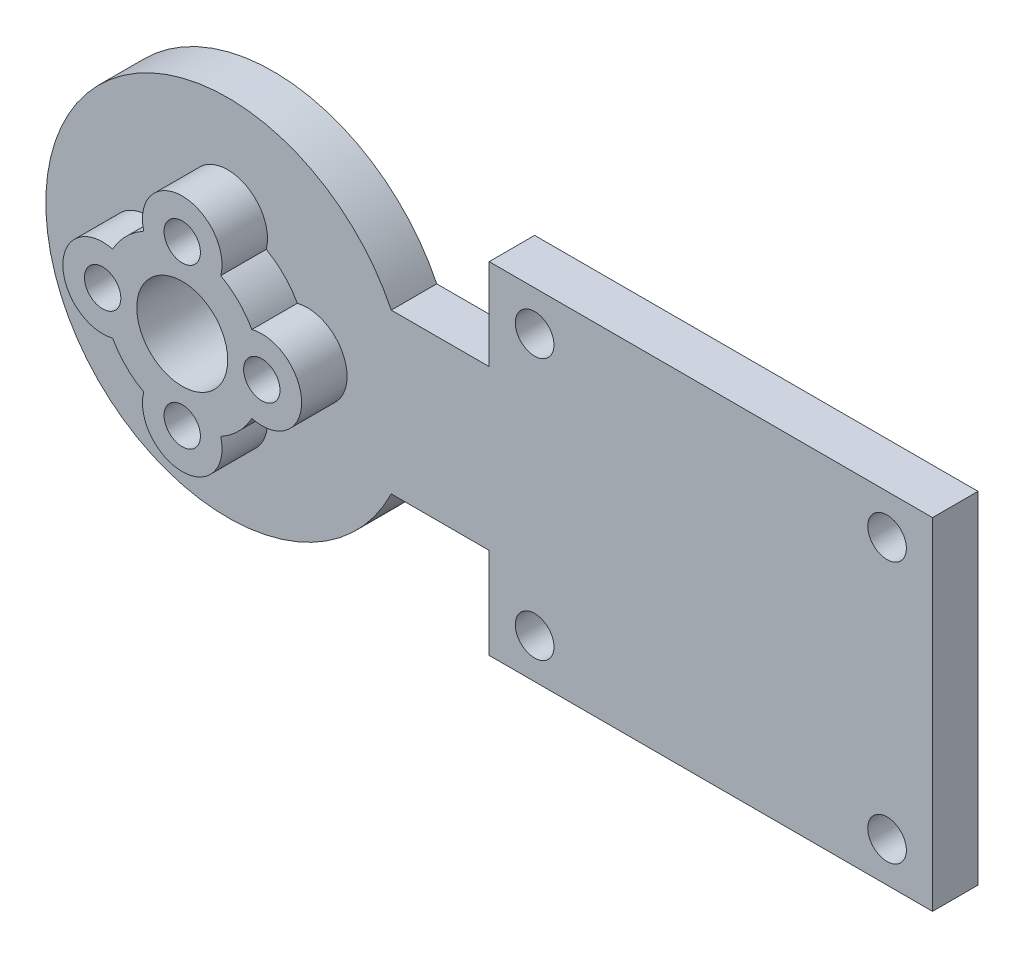
from build123d import *

# Parameters (mm, degrees)
METAL_HORN_FLANGE_PROFILE_R              = 16
METAL_HORN_FLANGE_DEPTH                  = 4
STRAIGHT_FOREARM_WEB_PROFILE_W           = 28
STRAIGHT_FOREARM_WEB_PROFILE_H           = 14
STRAIGHT_FOREARM_WEB_DEPTH               = 4
REPLACEABLE_TOOL_MOUNTING_DECK_PROFILE_W = 39
REPLACEABLE_TOOL_MOUNTING_DECK_PROFILE_H = 30
REPLACEABLE_TOOL_MOUNTING_DECK_DEPTH     = 4
DOWEL_SUPPORT_HUB_START                  = 4
DOWEL_SUPPORT_HUB_PROFILE_R              = 7
DOWEL_SUPPORT_HUB_PROFILE_R_2            = 4
DOWEL_SUPPORT_HUB_DEPTH                  = 4
WASHER_SEATS_CLEAR_DOWEL_SLEEVE_START    = 4
RAISED_WASHER_SEATS_PCD14_R              = 3.5
WASHER_SEATS_CLEAR_DOWEL_SLEEVE_DEPTH    = 4
METAL_HORN_M3_PATTERN_START              = -50
METAL_HORN_M3_PATTERN_PROFILE_R          = 1.6
METAL_HORN_M3_PATTERN_DEPTH              = 115.52906322
ELBOW_SLEEVE_BORE_START                  = -50
ELBOW_SLEEVE_BORE_PROFILE_R              = 4
ELBOW_SLEEVE_BORE_DEPTH                  = 115.52906322
MODULAR_TOOL_FOUR_M3_PATTERN_START       = -50
MODULAR_TOOL_FOUR_M3_PATTERN_PROFILE_R   = 1.7
MODULAR_TOOL_FOUR_M3_PATTERN_DEPTH       = 115.52906322


with BuildPart() as part:
    # Metal_horn_flange_profile → Metal_horn_flange (new body)
    with BuildSketch(Plane.XY):
        Circle(METAL_HORN_FLANGE_PROFILE_R)
    extrude(amount=METAL_HORN_FLANGE_DEPTH)

    # Straight_forearm_web_profile → Straight_forearm_web (add)
    with BuildSketch(Plane.XY):
        with Locations((14, 0)):
            Rectangle(STRAIGHT_FOREARM_WEB_PROFILE_W, STRAIGHT_FOREARM_WEB_PROFILE_H)
    extrude(amount=STRAIGHT_FOREARM_WEB_DEPTH)

    # Replaceable_tool_mounting_deck_profile → Replaceable_tool_mounting_deck (add)
    with BuildSketch(Plane.XY):
        with Locations((42.5, 0)):
            Rectangle(REPLACEABLE_TOOL_MOUNTING_DECK_PROFILE_W, REPLACEABLE_TOOL_MOUNTING_DECK_PROFILE_H)
    extrude(amount=REPLACEABLE_TOOL_MOUNTING_DECK_DEPTH)

    # Dowel_support_hub_profile → Dowel_support_hub (add)
    with BuildSketch(Plane.XY.offset(DOWEL_SUPPORT_HUB_START)):
        Circle(DOWEL_SUPPORT_HUB_PROFILE_R)
        Circle(DOWEL_SUPPORT_HUB_PROFILE_R_2, mode=Mode.SUBTRACT)
    extrude(amount=DOWEL_SUPPORT_HUB_DEPTH)

    # Raised_washer_seats_PCD14 → Washer_seats_clear_dowel_sleeve (add)
    with BuildSketch(Plane.XY.offset(WASHER_SEATS_CLEAR_DOWEL_SLEEVE_START)):
        with Locations((7, 0)):
            Circle(RAISED_WASHER_SEATS_PCD14_R)
        with Locations((-7, 0)):
            Circle(RAISED_WASHER_SEATS_PCD14_R)
        with Locations((0, 7)):
            Circle(RAISED_WASHER_SEATS_PCD14_R)
        with Locations((0, -7)):
            Circle(RAISED_WASHER_SEATS_PCD14_R)
    extrude(amount=WASHER_SEATS_CLEAR_DOWEL_SLEEVE_DEPTH)

    # Metal_horn_M3_pattern_profile → Metal_horn_M3_pattern (cut, through all)
    with BuildSketch(Plane.XY.offset(METAL_HORN_M3_PATTERN_START)):
        with Locations(Location((7, 0, 0), (0, 0, 180))):
            Circle(METAL_HORN_M3_PATTERN_PROFILE_R)
        with Locations(Location((-7, 0, 0), (0, 0, 180))):
            Circle(METAL_HORN_M3_PATTERN_PROFILE_R)
        with Locations(Location((0, 7, 0), (0, 0, 180))):
            Circle(METAL_HORN_M3_PATTERN_PROFILE_R)
        with Locations(Location((0, -7, 0), (0, 0, 180))):
            Circle(METAL_HORN_M3_PATTERN_PROFILE_R)
    extrude(amount=METAL_HORN_M3_PATTERN_DEPTH, mode=Mode.SUBTRACT)

    # Elbow_sleeve_bore_profile → Elbow_sleeve_bore (cut, through all)
    with BuildSketch(Plane.XY.offset(ELBOW_SLEEVE_BORE_START)):
        Circle(ELBOW_SLEEVE_BORE_PROFILE_R)
    extrude(amount=ELBOW_SLEEVE_BORE_DEPTH, mode=Mode.SUBTRACT)

    # Modular_tool_four_M3_pattern_profile → Modular_tool_four_M3_pattern (cut, through all)
    with BuildSketch(Plane.XY.offset(MODULAR_TOOL_FOUR_M3_PATTERN_START)):
        with Locations(Location((27, -11.5, 0), (0, 0, 180))):
            Circle(MODULAR_TOOL_FOUR_M3_PATTERN_PROFILE_R)
        with Locations(Location((27, 11.5, 0), (0, 0, 180))):
            Circle(MODULAR_TOOL_FOUR_M3_PATTERN_PROFILE_R)
        with Locations(Location((58, -11.5, 0), (0, 0, 180))):
            Circle(MODULAR_TOOL_FOUR_M3_PATTERN_PROFILE_R)
        with Locations(Location((58, 11.5, 0), (0, 0, 180))):
            Circle(MODULAR_TOOL_FOUR_M3_PATTERN_PROFILE_R)
    extrude(amount=MODULAR_TOOL_FOUR_M3_PATTERN_DEPTH, mode=Mode.SUBTRACT)


solid = part.part
